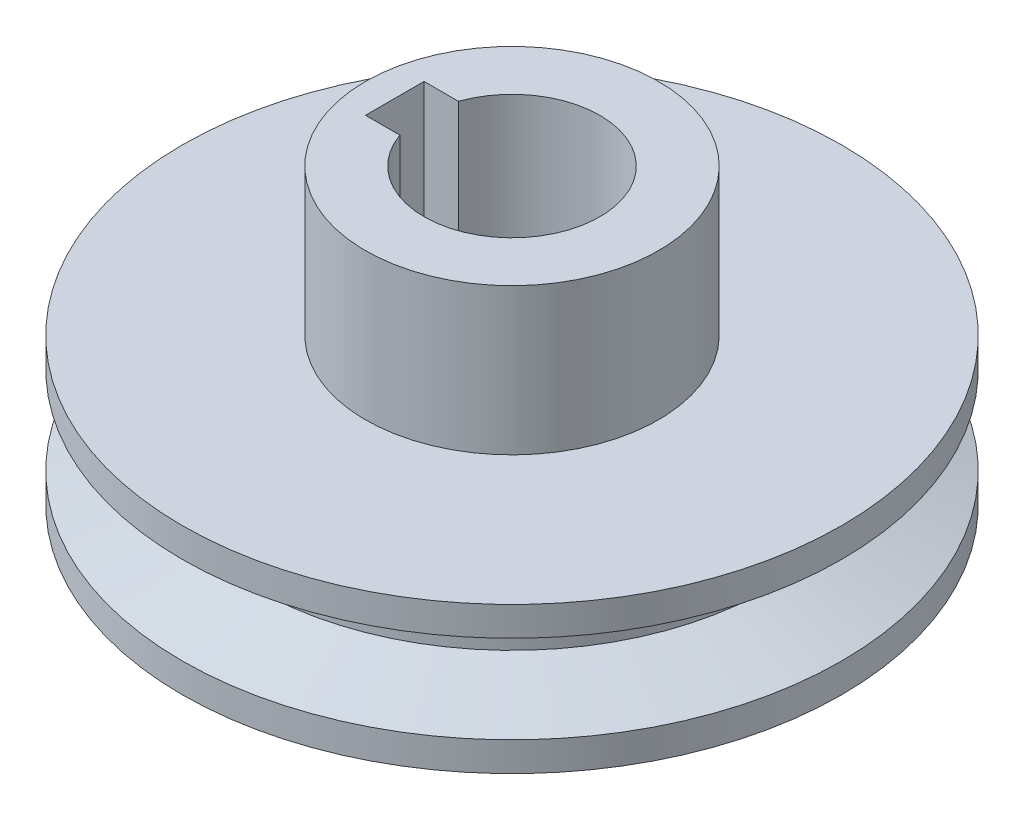
from build123d import *

# Parameters (mm, degrees)
SKETCH2_R          = 12
CUT_EXTRUDE1_DEPTH = 91.450262576
SKETCH3_W          = 16
SKETCH3_H          = 8
CUT_EXTRUDE2_DEPTH = 91.450262576


with BuildPart() as part:
    # Sketch1 → Revolve1 (revolve)
    with BuildSketch(Plane.XY):
        Polygon((-12.5, 2.5), (-12.5, -2.5), (-22.5, -6), (-22.5, -10), (22.5, -10), (22.5, 10), (22.5, 30), (2.5, 30), (2.5, 10), (-22.5, 10), (-22.5, 6), align=None)
    revolve(axis=Axis((22.5, 43.956272641, 0), (0, -1, 0)))

    # Sketch2 → Cut-Extrude1 (cut, through all)
    with BuildSketch(Plane(origin=(0, 30, 0), x_dir=(1, 0, 0), z_dir=(0, 1, 0))):
        with Locations(Location((22.5, 0, 0), (0, 0, 180))):
            Circle(SKETCH2_R)
    extrude(amount=-CUT_EXTRUDE1_DEPTH, mode=Mode.SUBTRACT)

    # Sketch3 → Cut-Extrude2 (cut, through all)
    with BuildSketch(Plane(origin=(0, 30, 0), x_dir=(1, 0, 0), z_dir=(0, 1, 0))):
        with Locations((14.5, 0)):
            Rectangle(SKETCH3_W, SKETCH3_H)
    extrude(amount=-CUT_EXTRUDE2_DEPTH, mode=Mode.SUBTRACT)


solid = part.part
